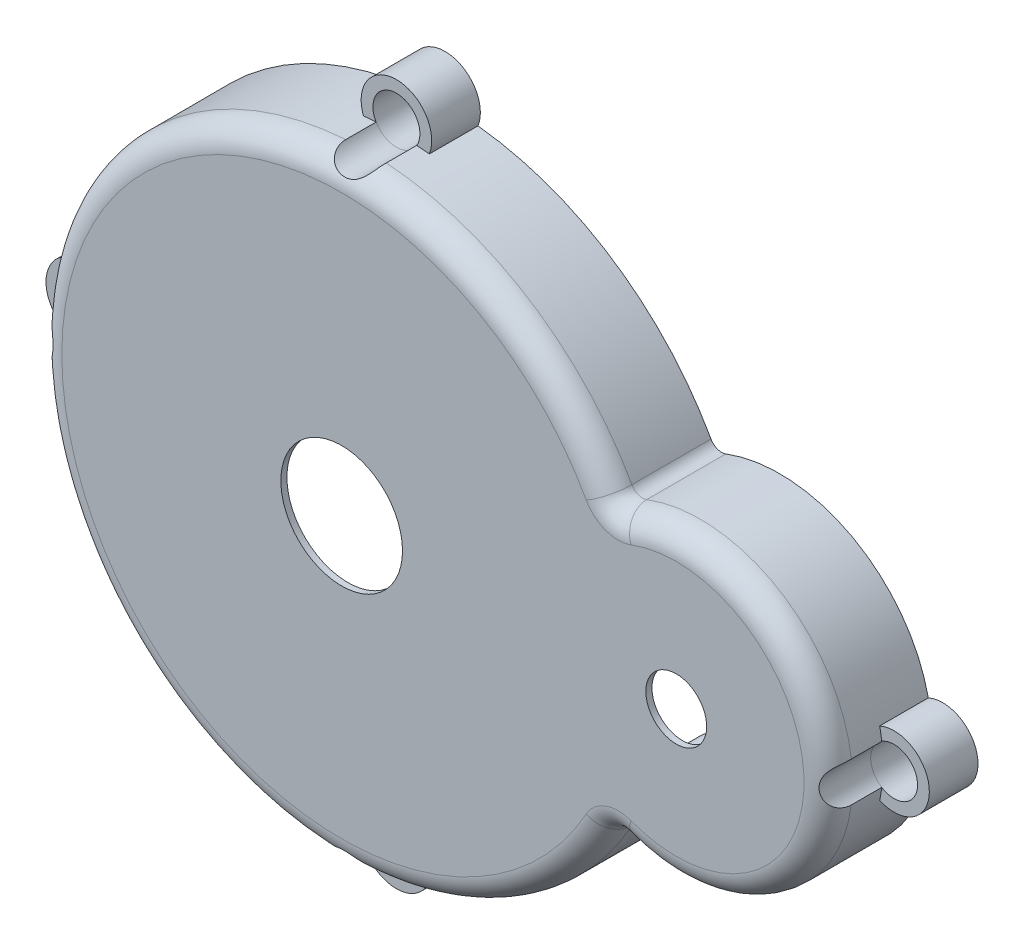
from build123d import *
from build123d.topology import SkipClean

# Parameters (mm, degrees)
BOSS_EXTRUDE1_DEPTH = 2.54
FILLET1_R           = 0.635
SKETCH5_R           = 3.175
SKETCH5_R_2         = 1.5875
BOSS_EXTRUDE2_DEPTH = 0.3175
FILLET2_R           = 1.27
BOSS_EXTRUDE3_START = 2.54
BOSS_EXTRUDE3_DEPTH = 2.54
SKETCH13_R          = 1.2192
CUT_EXTRUDE7_DEPTH  = 41.258098577


with BuildPart() as part:
    # Sketch1 → Boss-Extrude1 (new body)
    with BuildSketch(Plane.XY):
        with BuildLine():
            ThreePointArc((-3.319318182, -7.210134053), (7.9375, 0), (-3.319318182, 7.210134053))
            ThreePointArc((-3.319318182, 7.210134053), (-33.3375, 0), (-3.319318182, -7.210134053))
        make_face()
        with BuildLine():
            ThreePointArc((-3.896590909, 5.410372957), (6.6675, 0), (-3.896590909, -5.410372957))
            ThreePointArc((-3.896590909, -5.410372957), (-32.0675, 0), (-3.896590909, 5.410372957))
        make_face(mode=Mode.SUBTRACT)
    extrude(amount=BOSS_EXTRUDE1_DEPTH)

    # Fillet1
    fillet1_edges = [part.edges().sort_by_distance(p)[0] for p in [
        (-3.896590909, -5.410372957, 1.27),
        (-3.896590909, 5.410372957, 1.27),
        (-3.319318182, -7.210134053, 1.27),
        (-3.319318182, 7.210134053, 1.27),
    ]]
    fillet(fillet1_edges, radius=FILLET1_R)

    # Sketch5 → Boss-Extrude2 (add)
    with BuildSketch(Plane.XY.offset(2.54)):
        with BuildLine():
            add(Edge.make_bspline(
                [(-2.806186869, -7.424905488), (-2.845226608, -7.410150714), (-2.886557244, -7.398195299), (-2.929853337, -7.38956924), (-2.974573951, -7.384749752), (-3.065824583, -7.383219115), (-3.112368199, -7.386567362), (-3.158963721, -7.394293958), (-3.204788382, -7.406411801), (-3.293418384, -7.438879094), (-3.336227151, -7.459229798), (-3.376787781, -7.483430589), (-3.414480532, -7.510940141), (-3.483149603, -7.571053195), (-3.514174672, -7.603620141), (-3.541653398, -7.638172712), (-3.565481115, -7.673997192), (-3.585751748, -7.710478776)],
                knots=[0, 0, 0, 0, 0, 0, 0.249082558, 0.249082558, 0.249082558, 0.249082558, 0.5, 0.5, 0.5, 0.5, 0.750917442, 0.750917442, 0.750917442, 0.750917442, 1, 1, 1, 1, 1, 1], degree=5))
            ThreePointArc((-2.806186869, -7.424905488), (7.9375, 0), (-2.806186869, 7.424905488))
            add(Edge.make_bspline(
                [(-2.806186869, 7.424905488), (-2.845226608, 7.410150714), (-2.886557244, 7.398195299), (-2.929853337, 7.38956924), (-2.974573951, 7.384749752), (-3.065824583, 7.383219115), (-3.112368199, 7.386567362), (-3.158963721, 7.394293958), (-3.204788382, 7.406411801), (-3.293418384, 7.438879094), (-3.336227151, 7.459229798), (-3.376787781, 7.483430589), (-3.414480532, 7.510940141), (-3.483149603, 7.571053195), (-3.514174672, 7.603620141), (-3.541653398, 7.638172712), (-3.565481115, 7.673997192), (-3.585751748, 7.710478776)],
                knots=[0, 0, 0, 0, 0, 0, 0.249082558, 0.249082558, 0.249082558, 0.249082558, 0.5, 0.5, 0.5, 0.5, 0.750917442, 0.750917442, 0.750917442, 0.750917442, 1, 1, 1, 1, 1, 1], degree=5))
            ThreePointArc((-3.585751748, 7.710478776), (-33.3375, 0), (-3.585751748, -7.710478776))
        make_face()
        with Locations((-17.4625, 0)):
            Circle(SKETCH5_R, mode=Mode.SUBTRACT)
        Circle(SKETCH5_R_2, mode=Mode.SUBTRACT)
    extrude(amount=BOSS_EXTRUDE2_DEPTH)

    # Fillet2
    fillet2_edges = [part.edges().sort_by_distance(p)[0] for p in [
        (-3.249103383, 7.422645447, 2.8575),
        (-33.3375, 0, 2.8575),
        (-3.249103383, -7.422645447, 2.8575),
        (7.9375, 0, 2.8575),
    ]]
    fillet(fillet2_edges, radius=FILLET2_R)

    # Sketch7 → Boss-Extrude3 (add)
    with SkipClean():  # the faces are left unmerged after this step: merging them gives an invalid solid
        with BuildSketch(Plane(origin=(0, 0, 0), x_dir=(-1, 0, 0), z_dir=(0, 0, -1)).offset(BOSS_EXTRUDE3_START)):
            with BuildLine():
                ThreePointArc((-7.757425373, 1.681147772), (-6.963822514, 1.001772822), (-6.6675, 0))
                ThreePointArc((-6.6675, 0), (-3.353457068, 5.762801571), (3.294219368, 5.796867689))
                ThreePointArc((3.294219368, 5.796867689), (3.802975724, 5.744639363), (4.185227273, 6.08441073))
                ThreePointArc((4.185227273, 6.08441073), (9.574432864, 12.291640324), (17.4625, 14.605))
                ThreePointArc((17.4625, 14.605), (16.421553371, 14.927437011), (15.745135354, 15.781833977))
                ThreePointArc((15.745135354, 15.781833977), (8.682933783, 13.226293587), (3.585751748, 7.710478776))
                ThreePointArc((3.585751748, 7.710478776), (3.249103383, 7.422645447), (2.806186869, 7.424905488))
                ThreePointArc((2.806186869, 7.424905488), (-3.791619556, 6.973344061), (-7.757425373, 1.681147772))
            make_face()
            with BuildLine():
                ThreePointArc((3.294219368, -5.796867689), (-3.353457068, -5.762801571), (-6.6675, 0))
                ThreePointArc((-6.6675, 0), (-6.963822514, -1.001772822), (-7.757425373, -1.681147772))
                ThreePointArc((-7.757425373, -1.681147772), (-3.791619556, -6.973344061), (2.806186869, -7.424905488))
                ThreePointArc((2.806186869, -7.424905488), (3.249103383, -7.422645447), (3.585751748, -7.710478776))
                ThreePointArc((3.585751748, -7.710478776), (8.682933783, -13.226293587), (15.745135354, -15.781833977))
                ThreePointArc((15.745135354, -15.781833977), (16.421553371, -14.927437011), (17.4625, -14.605))
                ThreePointArc((17.4625, -14.605), (9.574432864, -12.291640324), (4.185227273, -6.08441073))
                ThreePointArc((4.185227273, -6.08441073), (3.802975724, -5.744639363), (3.294219368, -5.796867689))
            make_face()
            with BuildLine():
                ThreePointArc((-7.868434272, 1.04481977), (-7.819405396, 1.364113449), (-7.757425373, 1.681147772))
                ThreePointArc((-7.757425373, 1.681147772), (-10.3505, 0), (-7.757425373, -1.681147772))
                ThreePointArc((-7.757425373, -1.681147772), (-7.819405396, -1.364113449), (-7.868434272, -1.04481977))
                ThreePointArc((-7.868434272, -1.04481977), (-9.73455, 0), (-7.868434272, 1.04481977))
            make_face()
            with BuildLine():
                ThreePointArc((-7.757425373, -1.681147772), (-6.963822514, -1.001772822), (-6.6675, 0))
                Line((-6.6675, 0), (-7.28345, 0))
                ThreePointArc((-7.28345, 0), (-7.439650167, -0.598718413), (-7.868434272, -1.04481977))
                ThreePointArc((-7.868434272, -1.04481977), (-7.819405396, -1.364113449), (-7.757425373, -1.681147772))
            make_face()
            with BuildLine():
                Line((-7.28345, 0), (-6.6675, 0))
                ThreePointArc((-6.6675, 0), (-6.963822514, 1.001772822), (-7.757425373, 1.681147772))
                ThreePointArc((-7.757425373, 1.681147772), (-7.819405396, 1.364113449), (-7.868434272, 1.04481977))
                ThreePointArc((-7.868434272, 1.04481977), (-7.439650167, 0.598718413), (-7.28345, 0))
            make_face()
            with BuildLine():
                ThreePointArc((32.0675, 0), (27.789794539, -10.327294539), (17.4625, -14.605))
                ThreePointArc((17.4625, -14.605), (18.503446629, -14.927437011), (19.179864646, -15.781833977))
                ThreePointArc((19.179864646, -15.781833977), (28.687820151, -11.225320151), (33.244333977, -1.717364646))
                ThreePointArc((33.244333977, -1.717364646), (32.389937011, -1.040946629), (32.0675, 0))
            make_face()
            with BuildLine():
                ThreePointArc((19.179864646, -15.781833977), (18.503446629, -14.927437011), (17.4625, -14.605))
                Line((17.4625, -14.605), (17.4625, -15.22095))
                ThreePointArc((17.4625, -15.22095), (18.078039839, -15.386743656), (18.527037961, -15.839267153))
                ThreePointArc((18.527037961, -15.839267153), (18.853747703, -15.813919654), (19.179864646, -15.781833977))
            make_face()
            with BuildLine():
                Line((17.4625, -15.22095), (17.4625, -14.605))
                ThreePointArc((17.4625, -14.605), (16.421553371, -14.927437011), (15.745135354, -15.781833977))
                ThreePointArc((15.745135354, -15.781833977), (16.071252297, -15.813919654), (16.397962039, -15.839267153))
                ThreePointArc((16.397962039, -15.839267153), (16.846960161, -15.386743656), (17.4625, -15.22095))
            make_face()
            with BuildLine():
                ThreePointArc((16.397962039, -15.839267153), (16.071252297, -15.813919654), (15.745135354, -15.781833977))
                ThreePointArc((15.745135354, -15.781833977), (17.124420679, -18.256700161), (19.304, -16.4465))
                ThreePointArc((19.304, -16.4465), (19.272700161, -16.108420679), (19.179864646, -15.781833977))
                ThreePointArc((19.179864646, -15.781833977), (18.853747703, -15.813919654), (18.527037961, -15.839267153))
                ThreePointArc((18.527037961, -15.839267153), (18.647113292, -16.132391497), (18.68805, -16.4465))
                ThreePointArc((18.68805, -16.4465), (17.148391497, -17.631113292), (16.397962039, -15.839267153))
            make_face()
            with BuildLine():
                ThreePointArc((19.179864646, 15.781833977), (18.503446629, 14.927437011), (17.4625, 14.605))
                ThreePointArc((17.4625, 14.605), (27.789794539, 10.327294539), (32.0675, 0))
                ThreePointArc((32.0675, 0), (32.389937011, 1.040946629), (33.244333977, 1.717364646))
                ThreePointArc((33.244333977, 1.717364646), (28.687820151, 11.225320151), (19.179864646, 15.781833977))
            make_face()
            with BuildLine():
                ThreePointArc((19.304, 16.4465), (17.124420679, 18.256700161), (15.745135354, 15.781833977))
                ThreePointArc((15.745135354, 15.781833977), (16.071252297, 15.813919654), (16.397962039, 15.839267153))
                ThreePointArc((16.397962039, 15.839267153), (17.148391497, 17.631113292), (18.68805, 16.4465))
                ThreePointArc((18.68805, 16.4465), (18.647113292, 16.132391497), (18.527037961, 15.839267153))
                ThreePointArc((18.527037961, 15.839267153), (18.853747703, 15.813919654), (19.179864646, 15.781833977))
                ThreePointArc((19.179864646, 15.781833977), (19.272700161, 16.108420679), (19.304, 16.4465))
            make_face()
            with BuildLine():
                ThreePointArc((15.745135354, 15.781833977), (16.421553371, 14.927437011), (17.4625, 14.605))
                Line((17.4625, 14.605), (17.4625, 15.22095))
                ThreePointArc((17.4625, 15.22095), (16.846960161, 15.386743656), (16.397962039, 15.839267153))
                ThreePointArc((16.397962039, 15.839267153), (16.071252297, 15.813919654), (15.745135354, 15.781833977))
            make_face()
            with BuildLine():
                Line((17.4625, 15.22095), (17.4625, 14.605))
                ThreePointArc((17.4625, 14.605), (18.503446629, 14.927437011), (19.179864646, 15.781833977))
                ThreePointArc((19.179864646, 15.781833977), (18.853747703, 15.813919654), (18.527037961, 15.839267153))
                ThreePointArc((18.527037961, 15.839267153), (18.078039839, 15.386743656), (17.4625, 15.22095))
            make_face()
            with BuildLine():
                ThreePointArc((33.301767153, -1.064537961), (33.276419654, -1.391247703), (33.244333977, -1.717364646))
                ThreePointArc((33.244333977, -1.717364646), (34.949946629, -1.519062989), (35.7505, 0))
                ThreePointArc((35.7505, 0), (34.949946629, 1.519062989), (33.244333977, 1.717364646))
                ThreePointArc((33.244333977, 1.717364646), (33.276419654, 1.391247703), (33.301767153, 1.064537961))
                ThreePointArc((33.301767153, 1.064537961), (34.524539839, 1.059756344), (35.13455, 0))
                ThreePointArc((35.13455, 0), (34.524539839, -1.059756344), (33.301767153, -1.064537961))
            make_face()
            with BuildLine():
                ThreePointArc((33.244333977, 1.717364646), (32.389937011, 1.040946629), (32.0675, 0))
                Line((32.0675, 0), (32.68345, 0))
                ThreePointArc((32.68345, 0), (32.849243656, 0.615539839), (33.301767153, 1.064537961))
                ThreePointArc((33.301767153, 1.064537961), (33.276419654, 1.391247703), (33.244333977, 1.717364646))
            make_face()
            with BuildLine():
                Line((32.68345, 0), (32.0675, 0))
                ThreePointArc((32.0675, 0), (32.389937011, -1.040946629), (33.244333977, -1.717364646))
                ThreePointArc((33.244333977, -1.717364646), (33.276419654, -1.391247703), (33.301767153, -1.064537961))
                ThreePointArc((33.301767153, -1.064537961), (32.849243656, -0.615539839), (32.68345, 0))
            make_face()
        extrude(amount=-BOSS_EXTRUDE3_DEPTH)

    # Sketch13 → Cut-Extrude7 (cut, through all)
    with SkipClean():  # the faces are left unmerged after this step: merging them gives an invalid solid
        with BuildSketch(Plane(origin=(0, 0, 0), x_dir=(-1, 0, 0), z_dir=(0, 0, -1))):
            with Locations((-8.509, 0)):
                Circle(SKETCH13_R)
            with Locations((17.4625, 16.4465)):
                Circle(SKETCH13_R)
            with Locations((33.909, 0)):
                Circle(SKETCH13_R)
            with Locations((17.4625, -16.4465)):
                Circle(SKETCH13_R)
        extrude(amount=-CUT_EXTRUDE7_DEPTH, mode=Mode.SUBTRACT)


solid = part.part
